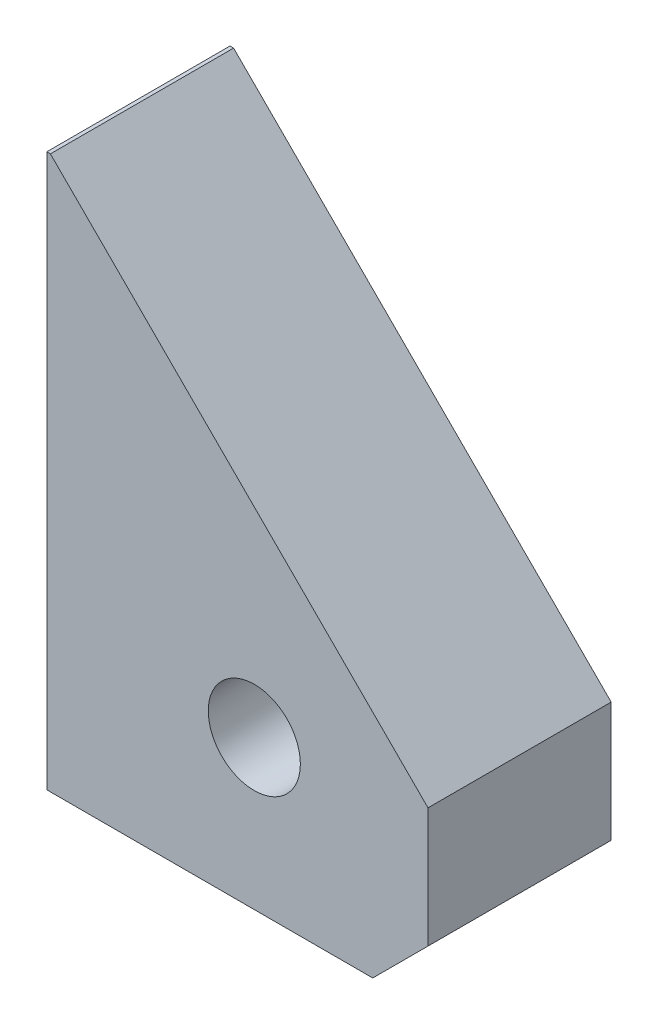
from build123d import *

# Parameters (mm, degrees)
SKETCH_4_W          = 20.69495493
SKETCH_4_H          = 9.945675455
EXTRUDE_4_DEPTH     = 30
CHAMFER_1_SIZE      = 20.5
CHAMFER_2_SIZE      = 3
SKETCH_5_R          = 2.499998555
CUT_EXTRUDE_1_DEPTH = 43.013443482


with BuildPart() as part:
    # Эскиз4 → Вытянуть4 (new body)
    with BuildSketch(Plane(origin=(0, 0, 0), x_dir=(1, 0, 0), z_dir=(0, 1, 0))):
        with Locations((17.333074787, 12.950285074)):
            Rectangle(SKETCH_4_W, SKETCH_4_H)
    extrude(amount=EXTRUDE_4_DEPTH)

    # Фаска1
    chamfer_1_edges = [part.edges().sort_by_distance(p)[0] for p in [
        (27.680552252, 30, -12.950285073),
    ]]
    chamfer(chamfer_1_edges, length=CHAMFER_1_SIZE)

    # Фаска2
    chamfer_2_edges = [part.edges().sort_by_distance(p)[0] for p in [
        (27.680552252, 0, -12.950285073),
    ]]
    chamfer(chamfer_2_edges, length=CHAMFER_2_SIZE)

    # Эскиз5 → Вырез-Вытянуть1 (cut, through all)
    with BuildSketch(Plane.XY.offset(-7.977447346)):
        with Locations((18.250594968, 8.095401179)):
            Circle(SKETCH_5_R)
    extrude(amount=-CUT_EXTRUDE_1_DEPTH, mode=Mode.SUBTRACT)


solid = part.part
